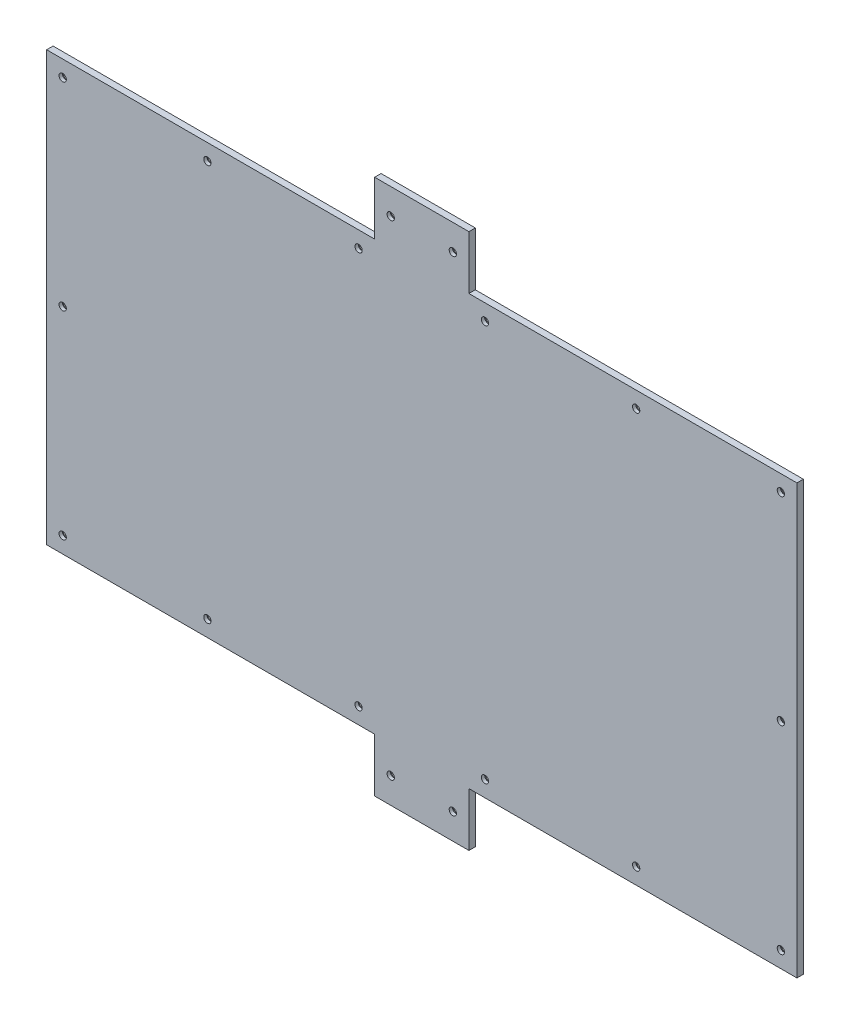
from build123d import *

# Parameters (mm, degrees)
BOSS_EXTRU_1_DEPTH                          = 3
FRAISAGE_POUR_VIS_T_TE_FRAIS_E_M31_AT_COUNT = 2
FRAISAGE_POUR_VIS_T_TE_FRAIS_E_M31_AT_PITCH = 92.5
FRAISAGE_POUR_VIS_T_TE_FRAIS_E_M31_2_COUNT  = 2
FRAISAGE_POUR_VIS_T_TE_FRAIS_E_M31_2_PITCH  = 185
FRAISAGE_POUR_VIS_T_TE_FRAIS_E_M32_AT_COUNT = 2
FRAISAGE_POUR_VIS_T_TE_FRAIS_E_M32_AT_PITCH = 185
FRAISAGE_POUR_VIS_T_TE_FRAIS_E_M32_2_COUNT  = 2
FRAISAGE_POUR_VIS_T_TE_FRAIS_E_M32_2_PITCH  = 92.5
FRAISAGE_POUR_VIS_T_TE_FRAIS_E_M33_AT_COUNT = 2
FRAISAGE_POUR_VIS_T_TE_FRAIS_E_M33_AT_PITCH = 226
FRAISAGE_POUR_VIS_T_TE_FRAIS_E_M33_2_COUNT  = 2
FRAISAGE_POUR_VIS_T_TE_FRAIS_E_M33_2_PITCH  = 222.583927109
FRAISAGE_POUR_VIS_T_TE_FRAIS_E_M33_3_COUNT  = 2
FRAISAGE_POUR_VIS_T_TE_FRAIS_E_M33_3_PITCH  = 235.236781008
FRAISAGE_POUR_VIS_T_TE_FRAIS_E_M33_4_COUNT  = 2
FRAISAGE_POUR_VIS_T_TE_FRAIS_E_M33_4_PITCH  = 116.302807958
FRAISAGE_POUR_VIS_T_TE_FRAIS_E_M33_5_COUNT  = 2
FRAISAGE_POUR_VIS_T_TE_FRAIS_E_M33_5_PITCH  = 87.940915433
FRAISAGE_POUR_VIS_T_TE_FRAIS_E_M33_6_COUNT  = 2
FRAISAGE_POUR_VIS_T_TE_FRAIS_E_M33_6_PITCH  = 28.963692658
FRAISAGE_POUR_VIS_T_TE_FRAIS_E_M33_7_COUNT  = 2
FRAISAGE_POUR_VIS_T_TE_FRAIS_E_M33_7_PITCH  = 227.84840463
FRAISAGE_POUR_VIS_T_TE_FRAIS_E_M33_8_COUNT  = 2
FRAISAGE_POUR_VIS_T_TE_FRAIS_E_M33_8_PITCH  = 25.401771592
FRAISAGE_POUR_VIS_T_TE_FRAIS_E_M33_9_COUNT  = 2
FRAISAGE_POUR_VIS_T_TE_FRAIS_E_M33_9_PITCH  = 206.046718003
FRAISAGE_POUR_VIS_T_TE_FRAIS_E_M33_10_COUNT = 2
FRAISAGE_POUR_VIS_T_TE_FRAIS_E_M33_10_PITCH = 210.150080353
FRAISAGE_POUR_VIS_T_TE_FRAIS_E_M33_11_COUNT = 2
FRAISAGE_POUR_VIS_T_TE_FRAIS_E_M33_11_PITCH = 48.508311372


with BuildPart() as part:
    # Esquisse2 → Boss.-Extru.1 (new body)
    with BuildSketch(Plane.XY):
        Polygon((-21.981846329, 125), (-21.981846329, 100), (-175, 100), (-175, -100), (-21.981846329, -100), (-21.981846329, -125), (21.981846329, -125), (21.981846329, -100), (175, -100), (175, 100), (21.981846329, 100), (21.981846329, 125), align=None)
    extrude(amount=BOSS_EXTRU_1_DEPTH)

    # Esquisse7 → Fraisage pour vis à tête fraisée M31 (revolve, cut)
    with BuildSketch(Plane(origin=(167.5, 92.5, 0), x_dir=(0, 1, 0), z_dir=(1, 0, 0))):
        Polygon((0, 0), (0, 3), (1.7, 3), (1.7, 1.45), (3.15, 0), align=None)
    fraisage_pour_vis_t_te_frais_e_m31 = revolve(axis=Axis((167.5, 92.5, -6.35), (0, 0, 1)), mode=Mode.SUBTRACT)

    # Fraisage pour vis à tête fraisée M31 at: Fraisage pour vis à tête fraisée M31 ×2
    with Locations(*[(0, -i * FRAISAGE_POUR_VIS_T_TE_FRAIS_E_M31_AT_PITCH, 0) for i in range(1, FRAISAGE_POUR_VIS_T_TE_FRAIS_E_M31_AT_COUNT)]):
        add(fraisage_pour_vis_t_te_frais_e_m31, mode=Mode.SUBTRACT)

    # Fraisage pour vis _ t_te frais_e M31 2: Fraisage pour vis à tête fraisée M31 ×2
    with Locations(*[(0, -i * FRAISAGE_POUR_VIS_T_TE_FRAIS_E_M31_2_PITCH, 0) for i in range(1, FRAISAGE_POUR_VIS_T_TE_FRAIS_E_M31_2_COUNT)]):
        add(fraisage_pour_vis_t_te_frais_e_m31, mode=Mode.SUBTRACT)

    # Esquisse9 → Fraisage pour vis à tête fraisée M32 (revolve, cut)
    with BuildSketch(Plane(origin=(-167.5, 92.5, 0), x_dir=(0, 1, 0), z_dir=(1, 0, 0))):
        Polygon((0, 0), (0, 3), (1.7, 3), (1.7, 1.45), (3.15, 0), align=None)
    fraisage_pour_vis_t_te_frais_e_m32 = revolve(axis=Axis((-167.5, 92.5, -6.35), (0, 0, 1)), mode=Mode.SUBTRACT)

    # Fraisage pour vis à tête fraisée M32 at: Fraisage pour vis à tête fraisée M32 ×2
    with Locations(*[(0, -i * FRAISAGE_POUR_VIS_T_TE_FRAIS_E_M32_AT_PITCH, 0) for i in range(1, FRAISAGE_POUR_VIS_T_TE_FRAIS_E_M32_AT_COUNT)]):
        add(fraisage_pour_vis_t_te_frais_e_m32, mode=Mode.SUBTRACT)

    # Fraisage pour vis _ t_te frais_e M32 2: Fraisage pour vis à tête fraisée M32 ×2
    with Locations(*[(0, -i * FRAISAGE_POUR_VIS_T_TE_FRAIS_E_M32_2_PITCH, 0) for i in range(1, FRAISAGE_POUR_VIS_T_TE_FRAIS_E_M32_2_COUNT)]):
        add(fraisage_pour_vis_t_te_frais_e_m32, mode=Mode.SUBTRACT)

    # Esquisse10 → Fraisage pour vis à tête fraisée M33 (revolve, cut)
    with BuildSketch(Plane(origin=(14.481846329, -113, 0), x_dir=(0, 1, 0), z_dir=(1, 0, 0))):
        Polygon((0, 0), (0, 3), (1.7, 3), (1.7, 1.45), (3.15, 0), align=None)
    fraisage_pour_vis_t_te_frais_e_m33 = revolve(axis=Axis((14.481846329, -113, -6.35), (0, 0, 1)), mode=Mode.SUBTRACT)

    # Fraisage pour vis à tête fraisée M33 at: Fraisage pour vis à tête fraisée M33 ×2
    with Locations(*[(0, i * FRAISAGE_POUR_VIS_T_TE_FRAIS_E_M33_AT_PITCH, 0) for i in range(1, FRAISAGE_POUR_VIS_T_TE_FRAIS_E_M33_AT_COUNT)]):
        add(fraisage_pour_vis_t_te_frais_e_m33, mode=Mode.SUBTRACT)

    # Fraisage pour vis _ t_te frais_e M33 2: Fraisage pour vis à tête fraisée M33 ×2
    with Locations(*[Vector(0.3842063296372473, 0.9232472563006483, 0) * (i * FRAISAGE_POUR_VIS_T_TE_FRAIS_E_M33_2_PITCH) for i in range(1, FRAISAGE_POUR_VIS_T_TE_FRAIS_E_M33_2_COUNT)]):
        add(fraisage_pour_vis_t_te_frais_e_m33, mode=Mode.SUBTRACT)

    # Fraisage pour vis _ t_te frais_e M33 3: Fraisage pour vis à tête fraisée M33 ×2
    with Locations(*[Vector(-0.4866664381255049, 0.8735878765197204, 0) * (i * FRAISAGE_POUR_VIS_T_TE_FRAIS_E_M33_3_PITCH) for i in range(1, FRAISAGE_POUR_VIS_T_TE_FRAIS_E_M33_3_COUNT)]):
        add(fraisage_pour_vis_t_te_frais_e_m33, mode=Mode.SUBTRACT)

    # Fraisage pour vis _ t_te frais_e M33 4: Fraisage pour vis à tête fraisée M33 ×2
    with Locations(*[Vector(-0.9843429263584751, 0.1762640159761305, 0) * (i * FRAISAGE_POUR_VIS_T_TE_FRAIS_E_M33_4_PITCH) for i in range(1, FRAISAGE_POUR_VIS_T_TE_FRAIS_E_M33_4_COUNT)]):
        add(fraisage_pour_vis_t_te_frais_e_m33, mode=Mode.SUBTRACT)

    # Fraisage pour vis _ t_te frais_e M33 5: Fraisage pour vis à tête fraisée M33 ×2
    with Locations(*[Vector(0.9724501189162041, 0.23311105984028424, 0) * (i * FRAISAGE_POUR_VIS_T_TE_FRAIS_E_M33_5_PITCH) for i in range(1, FRAISAGE_POUR_VIS_T_TE_FRAIS_E_M33_5_COUNT)]):
        add(fraisage_pour_vis_t_te_frais_e_m33, mode=Mode.SUBTRACT)

    # Fraisage pour vis _ t_te frais_e M33 6: Fraisage pour vis à tête fraisée M33 ×2
    with Locations(*[(-i * FRAISAGE_POUR_VIS_T_TE_FRAIS_E_M33_6_PITCH, 0, 0) for i in range(1, FRAISAGE_POUR_VIS_T_TE_FRAIS_E_M33_6_COUNT)]):
        add(fraisage_pour_vis_t_te_frais_e_m33, mode=Mode.SUBTRACT)

    # Fraisage pour vis _ t_te frais_e M33 7: Fraisage pour vis à tête fraisée M33 ×2
    with Locations(*[Vector(-0.12711825964048365, 0.9918875682586079, 0) * (i * FRAISAGE_POUR_VIS_T_TE_FRAIS_E_M33_7_PITCH) for i in range(1, FRAISAGE_POUR_VIS_T_TE_FRAIS_E_M33_7_COUNT)]):
        add(fraisage_pour_vis_t_te_frais_e_m33, mode=Mode.SUBTRACT)

    # Fraisage pour vis _ t_te frais_e M33 8: Fraisage pour vis à tête fraisée M33 ×2
    with Locations(*[Vector(0.5905099943842171, 0.8070303256584302, 0) * (i * FRAISAGE_POUR_VIS_T_TE_FRAIS_E_M33_8_PITCH) for i in range(1, FRAISAGE_POUR_VIS_T_TE_FRAIS_E_M33_8_COUNT)]):
        add(fraisage_pour_vis_t_te_frais_e_m33, mode=Mode.SUBTRACT)

    # Fraisage pour vis _ t_te frais_e M33 9: Fraisage pour vis à tête fraisée M33 ×2
    with Locations(*[Vector(0.07279902415018125, 0.9973466308574875, 0) * (i * FRAISAGE_POUR_VIS_T_TE_FRAIS_E_M33_9_PITCH) for i in range(1, FRAISAGE_POUR_VIS_T_TE_FRAIS_E_M33_9_COUNT)]):
        add(fraisage_pour_vis_t_te_frais_e_m33, mode=Mode.SUBTRACT)

    # Fraisage pour vis _ t_te frais_e M33 10: Fraisage pour vis à tête fraisée M33 ×2
    with Locations(*[Vector(-0.20920140779710872, 0.9778725739970969, 0) * (i * FRAISAGE_POUR_VIS_T_TE_FRAIS_E_M33_10_PITCH) for i in range(1, FRAISAGE_POUR_VIS_T_TE_FRAIS_E_M33_10_COUNT)]):
        add(fraisage_pour_vis_t_te_frais_e_m33, mode=Mode.SUBTRACT)

    # Fraisage pour vis _ t_te frais_e M33 11: Fraisage pour vis à tête fraisée M33 ×2
    with Locations(*[Vector(-0.90631257644203, 0.4226079906757676, 0) * (i * FRAISAGE_POUR_VIS_T_TE_FRAIS_E_M33_11_PITCH) for i in range(1, FRAISAGE_POUR_VIS_T_TE_FRAIS_E_M33_11_COUNT)]):
        add(fraisage_pour_vis_t_te_frais_e_m33, mode=Mode.SUBTRACT)


solid = part.part
